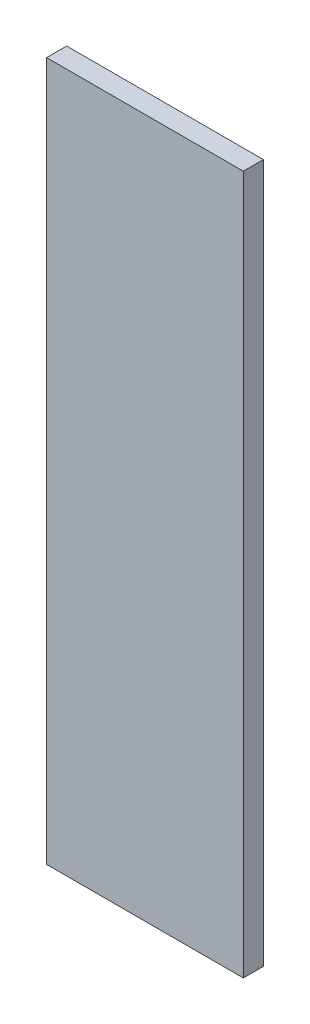
from build123d import *

# Parameters (mm, degrees)
SKETCH1_W           = 0.49
SKETCH1_H           = 1.74
BOSS_EXTRUDE1_DEPTH = 0.05


with BuildPart() as part:
    # Sketch1 → Boss-Extrude1 (new body)
    with BuildSketch(Plane.XY):
        with Locations((-0.005, 0)):
            Rectangle(SKETCH1_W, SKETCH1_H)
    extrude(amount=-BOSS_EXTRUDE1_DEPTH)


solid = part.part
